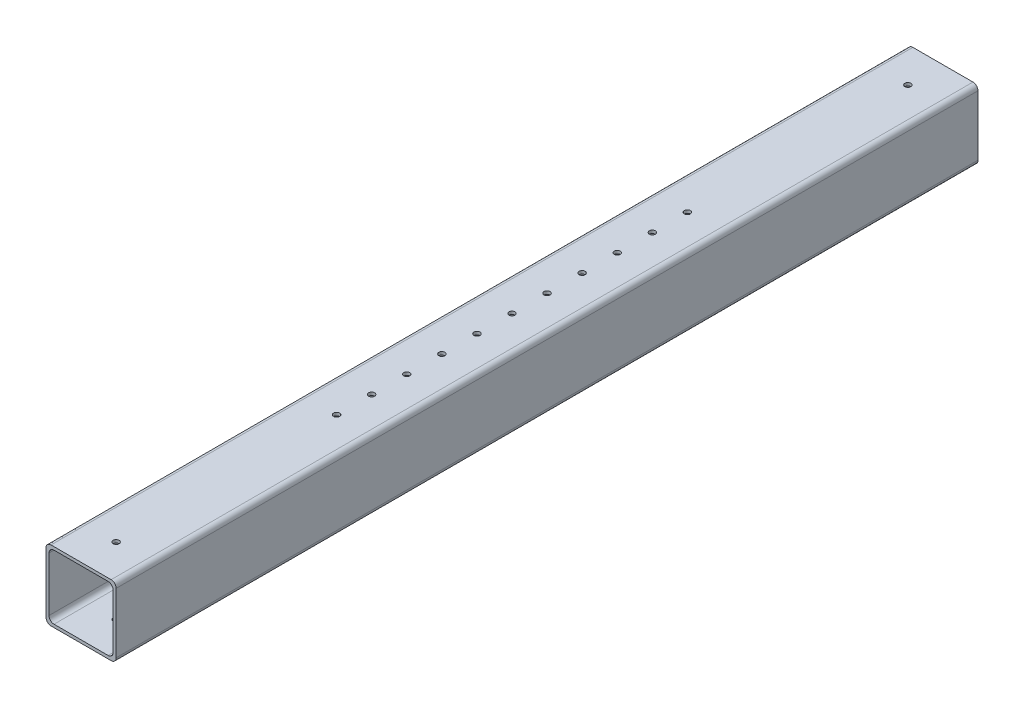
from build123d import *

# Parameters (mm, degrees)
SKETCH1_W           = 70
SKETCH1_H           = 70
SKETCH1_W_2         = 64
SKETCH1_H_2         = 64
BOSS_EXTRUDE1_DEPTH = 860
FILLET1_R           = 5
SKETCH2_R           = 3
CUT_EXTRUDE1_DEPTH  = 70
SKETCH3_R           = 3
CUT_EXTRUDE2_DEPTH  = 173
LPATTERN1_COUNT     = 6
LPATTERN1_PITCH     = 35
LPATTERN1_COL_COUNT = 6
LPATTERN1_COL_PITCH = 35


with BuildPart() as part:
    # Sketch1 → Boss-Extrude1 (new body)
    with BuildSketch(Plane.XY):
        with Locations((35, 35)):
            Rectangle(SKETCH1_W, SKETCH1_H)
        with Locations((35, 35)):
            Rectangle(SKETCH1_W_2, SKETCH1_H_2, mode=Mode.SUBTRACT)
    extrude(amount=BOSS_EXTRUDE1_DEPTH)

    # Fillet1
    fillet1_edges = [part.edges().sort_by_distance(p)[0] for p in [
        (3, 67, 430),
        (3, 3, 430),
        (67, 3, 430),
        (67, 67, 430),
        (0, 70, 430),
        (70, 70, 430),
        (70, 0, 430),
        (0, 0, 430),
    ]]
    fillet(fillet1_edges, radius=FILLET1_R)

    # Sketch2 → Cut-Extrude1 (cut)
    with BuildSketch(Plane(origin=(0, 70, 0), x_dir=(1, 0, 0), z_dir=(0, 1, 0))):
        with Locations(Location((35, -825, 0), (0, 0, 270))):
            Circle(SKETCH2_R)
        with Locations(Location((35, -35, 0), (0, 0, 270))):
            Circle(SKETCH2_R)
    extrude(amount=-CUT_EXTRUDE1_DEPTH, mode=Mode.SUBTRACT)

    # Sketch3 → Cut-Extrude2 (cut)
    with BuildSketch(Plane.XZ):
        with Locations(Location((35, 430, 0), (0, 0, 270))):
            Circle(SKETCH3_R)
    cut_extrude2 = extrude(amount=-CUT_EXTRUDE2_DEPTH, mode=Mode.SUBTRACT)

    # LPattern1: Cut-Extrude2 ×6
    with Locations(*[(0, 0, -i * LPATTERN1_PITCH) for i in range(1, LPATTERN1_COUNT)]):
        add(cut_extrude2, mode=Mode.SUBTRACT)

    # LPattern1 col: Cut-Extrude2 ×6
    with Locations(*[(0, 0, i * LPATTERN1_COL_PITCH) for i in range(1, LPATTERN1_COL_COUNT)]):
        add(cut_extrude2, mode=Mode.SUBTRACT)


solid = part.part
